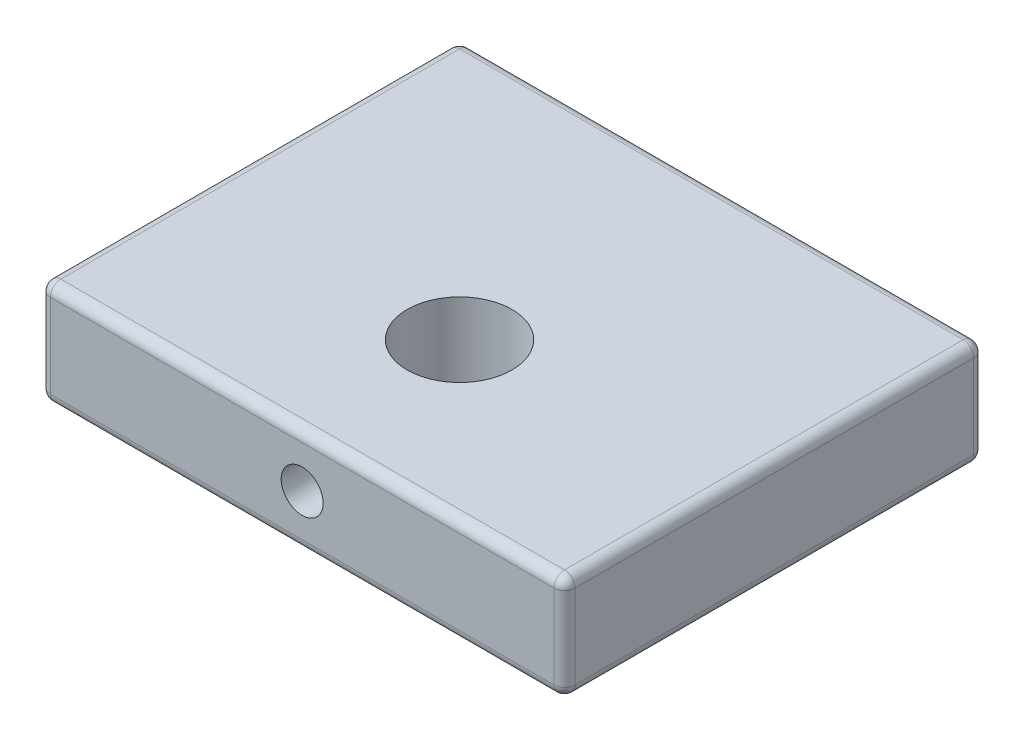
from build123d import *

# Parameters (mm, degrees)
SKETCH1_W           = 50
SKETCH1_H           = 40
SKETCH1_R           = 5
BOSS_EXTRUDE1_DEPTH = 10
SKETCH2_R           = 0.75
CUT_EXTRUDE1_DEPTH  = 5
CUT_EXTRUDE2_REACH  = 50.218
SKETCH3_R           = 2
FILLET1_R           = 1


with BuildPart() as part:
    # Sketch1 → Boss-Extrude1 (new body)
    with BuildSketch(Plane(origin=(0, 0, 0), x_dir=(1, 0, 0), z_dir=(0, 1, 0))):
        with Locations((0, 5)):
            Rectangle(SKETCH1_W, SKETCH1_H)
        Circle(SKETCH1_R, mode=Mode.SUBTRACT)
    extrude(amount=BOSS_EXTRUDE1_DEPTH)

    # Sketch2 → Cut-Extrude1 (cut)
    with BuildSketch(Plane.XZ):
        with Locations((-11.313708499, 11.313708499)):
            Circle(SKETCH2_R)
        with Locations((11.313708499, 11.313708499)):
            Circle(SKETCH2_R)
        with Locations((11.313708499, -11.313708499)):
            Circle(SKETCH2_R)
        with Locations((-11.313708499, -11.313708499)):
            Circle(SKETCH2_R)
    extrude(amount=-CUT_EXTRUDE1_DEPTH, mode=Mode.SUBTRACT)

    # Sketch3 → Cut-Extrude2 (cut, up to next)
    with BuildSketch(Plane.XY.offset(15), mode=Mode.PRIVATE) as cut_extrude2_sk1:
        with Locations((0, 5)):
            Circle(SKETCH3_R)
    cut_extrude2_tool1 = extrude(cut_extrude2_sk1.sketch, amount=-CUT_EXTRUDE2_REACH, mode=Mode.PRIVATE) & part.part
    add(cut_extrude2_tool1.solids().sort_by_distance((0, 5, 15))[0], mode=Mode.SUBTRACT)

    # Fillet1
    fillet1_edges = [part.edges().sort_by_distance(p)[0] for p in [
        (-25, 10, -5),
        (-25, 5, 15),
        (-25, 0, -5),
        (0, 10, -25),
        (-25, 5, -25),
        (0, 0, -25),
        (25, 5, 15),
        (25, 10, -5),
        (25, 5, -25),
        (25, 0, -5),
        (0, 0, 15),
        (0, 10, 15),
    ]]
    fillet(fillet1_edges, radius=FILLET1_R)


solid = part.part
